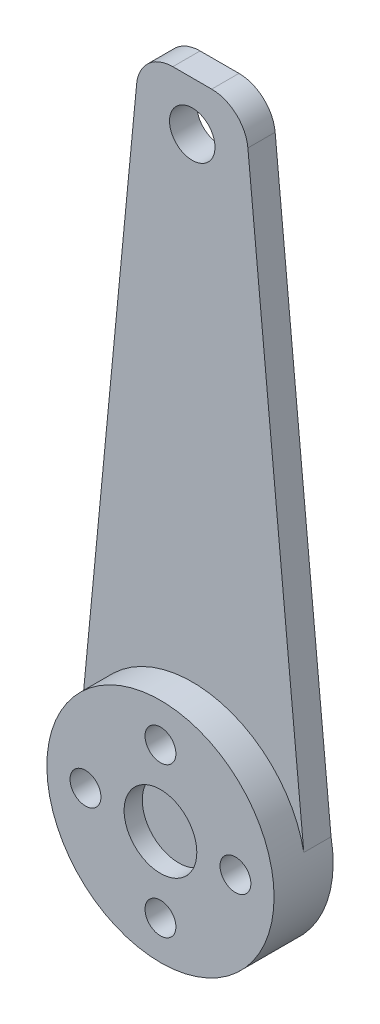
from build123d import *

# Parameters (mm, degrees)
ESQUISSE2_R                  = 12.5
BOSS_EXTRU_1_DEPTH           = 3.25
ESQUISSE3_R                  = 1.2
ENL_V_MAT_EXTRU_1_DEPTH      = 18.973939468
BOSS_EXTRU_2_DEPTH           = 3
ENL_V_MAT_EXTRU_2_DEPTH      = 72.455982989
ENL_V_MAT_EXTRU_2_DEPTH_BACK = 72.455982989
ESQUISSE10_R                 = 1.7
ESQUISSE17_R                 = 4
ENL_V_MAT_EXTRU_8_DEPTH      = 2
CONG_1_R                     = 4
ESQUISSE21_R                 = 2.5
ENL_V_MAT_EXTRU_9_DEPTH      = 72.455982989


with BuildPart() as part:
    # Esquisse2 → Boss.-Extru.1 (new, symmetric)
    with BuildSketch(Plane.XY):
        with Locations(Location((0, 0, 0), (0, 0, 180))):
            Circle(ESQUISSE2_R)
    extrude(amount=BOSS_EXTRU_1_DEPTH, both=True)

    # Esquisse3 → Enlèv. mat.-Extru.1 (cut, through all)
    with BuildSketch(Plane.XY):
        with Locations(Location((0, 8.25, 0), (0, 0, 180))):
            Circle(ESQUISSE3_R)
        with Locations(Location((-8.25, 0, 0), (0, 0, 180))):
            Circle(ESQUISSE3_R)
        with Locations(Location((0, -8.25, 0), (0, 0, 180))):
            Circle(ESQUISSE3_R)
        with Locations(Location((8.25, 0, 0), (0, 0, 180))):
            Circle(ESQUISSE3_R)
    extrude(amount=ENL_V_MAT_EXTRU_1_DEPTH, mode=Mode.SUBTRACT)

    # Esquisse20 → Boss.-Extru.2 (add)
    with BuildSketch(Plane(origin=(0, 0, -3.25), x_dir=(-1, 0, 0), z_dir=(0, 0, -1))):
        Polygon((-12.5, 0), (-5.772196938, 70.05324764), (5.772196938, 70.05324764), (12.5, 0), align=None)
    extrude(amount=-BOSS_EXTRU_2_DEPTH)

    # Esquisse10 → Enlèv. mat.-Extru.2 (cut, two sides: drawn at the far end of the back side and taken through both)
    with BuildSketch(Plane(origin=(0, 0, -3.25), x_dir=(-1, 0, 0), z_dir=(0, 0, -1)).offset(-ENL_V_MAT_EXTRU_2_DEPTH_BACK)):
        with Locations((-8.25, 0)):
            Circle(ESQUISSE10_R)
        with Locations((0, 8.25)):
            Circle(ESQUISSE10_R)
        with Locations((8.25, 0)):
            Circle(ESQUISSE10_R)
        with Locations((0, -8.25)):
            Circle(ESQUISSE10_R)
    extrude(amount=ENL_V_MAT_EXTRU_2_DEPTH + ENL_V_MAT_EXTRU_2_DEPTH_BACK, mode=Mode.SUBTRACT)

    # Esquisse17 → Enlèv. mat.-Extru.8 (cut)
    with BuildSketch(Plane.XY.offset(3.25)):
        Circle(ESQUISSE17_R)
    extrude(amount=-ENL_V_MAT_EXTRU_8_DEPTH, mode=Mode.SUBTRACT)

    # Congé1
    cong_1_edges = [part.edges().sort_by_distance(p)[0] for p in [
        (-5.772196938, 70.05324764, -1.75),
        (5.772196938, 70.05324764, -1.75),
    ]]
    fillet(cong_1_edges, radius=CONG_1_R)

    # Esquisse21 → Enlèv. mat.-Extru.9 (cut, through all)
    with BuildSketch(Plane(origin=(0, 0, -3.25), x_dir=(-1, 0, 0), z_dir=(0, 0, -1))):
        with Locations((0, 64.696529063)):
            Circle(ESQUISSE21_R)
    extrude(amount=-ENL_V_MAT_EXTRU_9_DEPTH, mode=Mode.SUBTRACT)


solid = part.part
